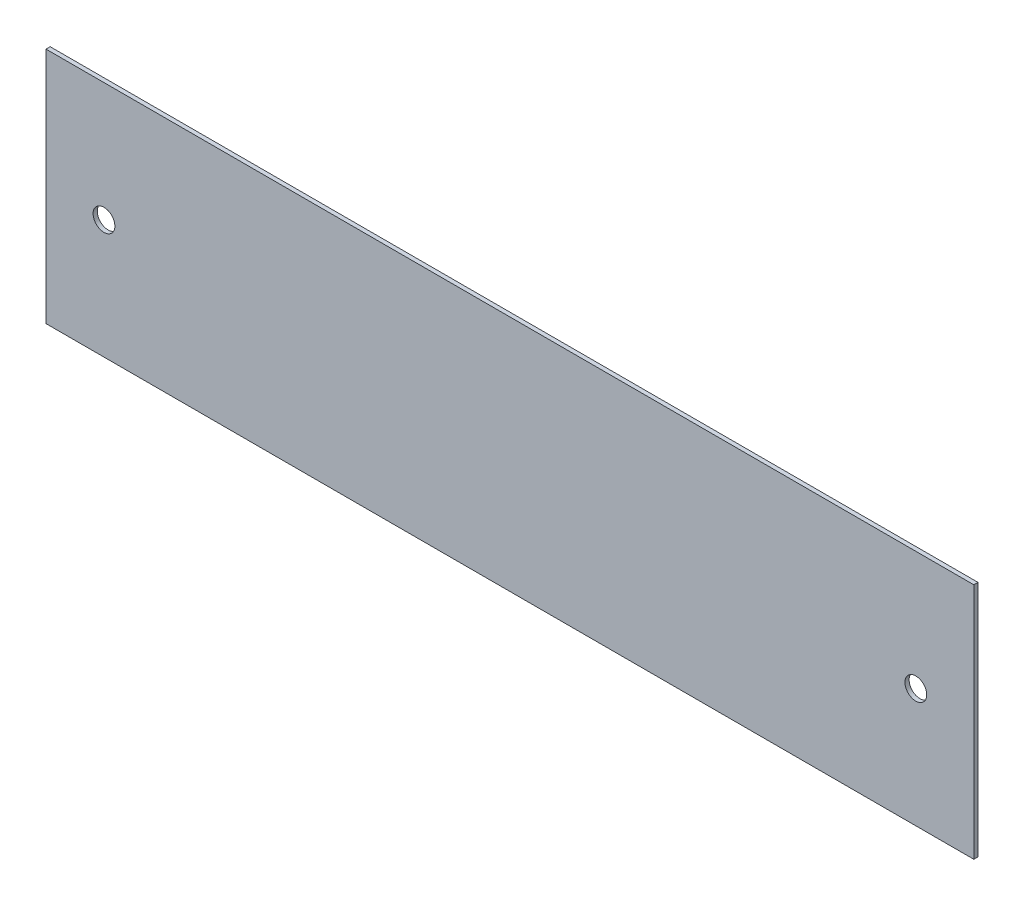
from build123d import *

# Parameters (mm, degrees)
SKETCH2_W               = 288
SKETCH2_H               = 73.8
BOSS_EXTRUDE1_DEPTH     = 1.2954
F_1_4_CLEARANCE_HOLE1_D = 6.7564


with BuildPart() as part:
    # Sketch2 → Boss-Extrude1 (new body)
    with BuildSketch(Plane.XY):
        Rectangle(SKETCH2_W, SKETCH2_H)
    extrude(amount=BOSS_EXTRUDE1_DEPTH)

    # 1/4 Clearance Hole1 (through all)
    with Locations(Plane.XY.offset(1.2954)):
        with Locations((-126, 0), (126, 0)):
            Hole(F_1_4_CLEARANCE_HOLE1_D / 2)


solid = part.part
